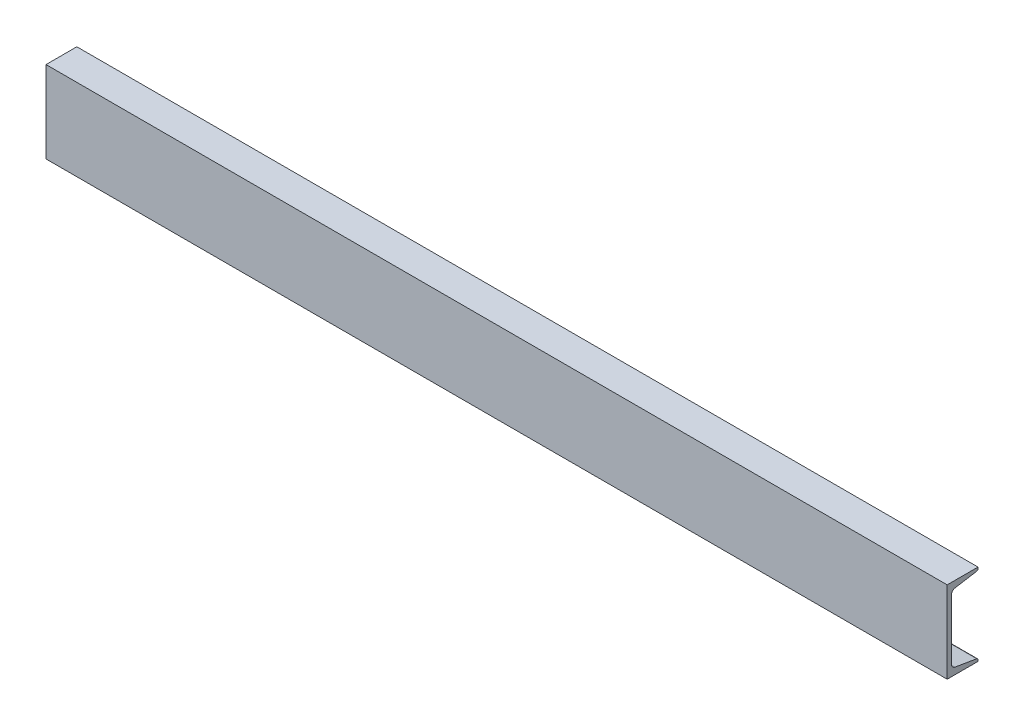
from build123d import *

# Parameters (mm, degrees)
CANAL_C_3_X_5_1_DEPTH = 1400


with BuildPart() as part:
    # Sketch12 → Canal c 3 X 5(1) (new body)
    with BuildSketch(Plane(origin=(0, 0, 0), x_dir=(0, 0, -1), z_dir=(1, 0, 0))):
        with BuildLine():
            Line((0, -63.5), (0, 63.5))
            Line((0, 63.5), (47.9, 63.5))
            Line((47.9, 63.5), (47.9, 61.342335136))
            ThreePointArc((47.9, 61.342335136), (47.298080466, 59.700554363), (45.777603066, 58.836899509))
            Line((45.777603066, 58.836899509), (12.283671721, 53.254170388))
            ThreePointArc((12.283671721, 53.254170388), (8.178382741, 50.922302283), (6.5532, 46.489494196))
            Line((6.5532, 46.489494196), (6.5532, -46.489494196))
            ThreePointArc((6.5532, -46.489494196), (8.178382741, -50.922302283), (12.283671721, -53.254170388))
            Line((12.283671721, -53.254170388), (45.777603066, -58.836899509))
            ThreePointArc((45.777603066, -58.836899509), (47.298080466, -59.700554363), (47.9, -61.342335136))
            Line((47.9, -61.342335136), (47.9, -63.5))
            Line((47.9, -63.5), (0, -63.5))
        make_face()
    extrude(amount=CANAL_C_3_X_5_1_DEPTH)


solid = part.part
